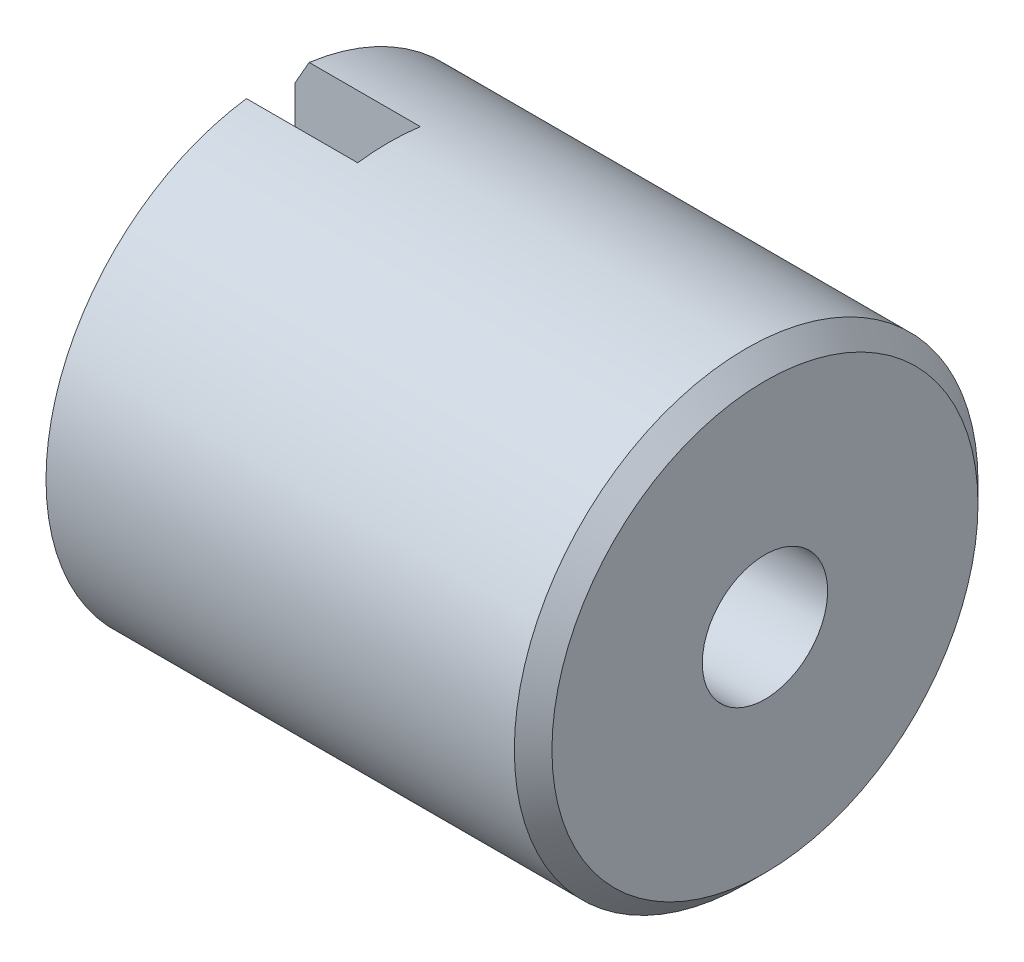
from build123d import *

# Parameters (mm, degrees)
CHANFREIN1_SIZE         = 0.6905
CHANFREIN1_SIZE2        = 0.398660361
ESQUISSE3_R             = 2.55
ENL_V_MAT_EXTRU_2_DEPTH = 2.2
ESQUISSE4_R             = 4
ENL_V_MAT_EXTRU_3_DEPTH = 12.2
CHANFREIN2_SIZE         = 0.6
ESQUISSE5_OUTSIDE_W     = 12.772
ESQUISSE5_OUTSIDE_H     = 12.772
ESQUISSE5_OUTSIDE_R     = 3.7
ENL_V_MAT_EXTRU_4_DEPTH = 10.797958971
ESQUISSE6_W             = 1
ESQUISSE6_H             = 2.203007131
ENL_V_MAT_EXTRU_5_DEPTH = 2
ESQUISSE7_R             = 1
ENL_V_MAT_EXTRU_6_DEPTH = 8.81152994


with BuildPart() as part:
    # Esquisse1 → Révolution1 (revolve)
    with BuildSketch(Plane.XY, mode=Mode.PRIVATE) as r_volution1_sk:
        Polygon((0, 4), (0, 0), (12.000000001, 0), (8, 4), align=None)
    revolve(r_volution1_sk.sketch.rotate(Axis((0, 0, 0), (1, 0, 0)), 270), axis=Axis((0, 0, 0), (1, 0, 0)))

    # Chanfrein1
    chanfrein1_edges = [part.edges().sort_by_distance(p)[0] for p in [
        (0, 0, 4),
    ]]
    chanfrein1_side = [part.faces().sort_by_distance(p)[0] for p in [
        (0, 0, 0),
    ]]
    chamfer(chanfrein1_edges, length=CHANFREIN1_SIZE, length2=CHANFREIN1_SIZE2, reference=chanfrein1_side[0])

    # Esquisse3 → Enlèv. mat.-Extru.2 (cut)
    with BuildSketch(Plane.ZY):
        Circle(ESQUISSE3_R)
    extrude(amount=-ENL_V_MAT_EXTRU_2_DEPTH, mode=Mode.SUBTRACT)

    # Esquisse4 → Enlèv. mat.-Extru.3 (cut)
    with BuildSketch(Plane.ZY.offset(-8)):
        Circle(ESQUISSE4_R)
    extrude(amount=-ENL_V_MAT_EXTRU_3_DEPTH, mode=Mode.SUBTRACT)

    # Chanfrein2
    chanfrein2_edges = [part.edges().sort_by_distance(p)[0] for p in [
        (8, 0, 4),
    ]]
    chamfer(chanfrein2_edges, length=CHANFREIN2_SIZE)

    # Esquisse5 outside → Enlèv. mat.-Extru.4 (cut, through all)
    with BuildSketch(Plane.ZY):
        Rectangle(ESQUISSE5_OUTSIDE_W, ESQUISSE5_OUTSIDE_H)
        Circle(ESQUISSE5_OUTSIDE_R, mode=Mode.SUBTRACT)
    extrude(amount=-ENL_V_MAT_EXTRU_4_DEPTH, mode=Mode.SUBTRACT)

    # Esquisse6 → Enlèv. mat.-Extru.5 (cut)
    with BuildSketch(Plane.ZY):
        with Locations((0, 3.309500001)):
            Rectangle(ESQUISSE6_W, ESQUISSE6_H)
    extrude(amount=-ENL_V_MAT_EXTRU_5_DEPTH, mode=Mode.SUBTRACT)

    # Esquisse7 → Enlèv. mat.-Extru.6 (cut, through all)
    with BuildSketch(Plane.ZY.offset(-2.2)):
        Circle(ESQUISSE7_R)
    extrude(amount=-ENL_V_MAT_EXTRU_6_DEPTH, mode=Mode.SUBTRACT)


solid = part.part
